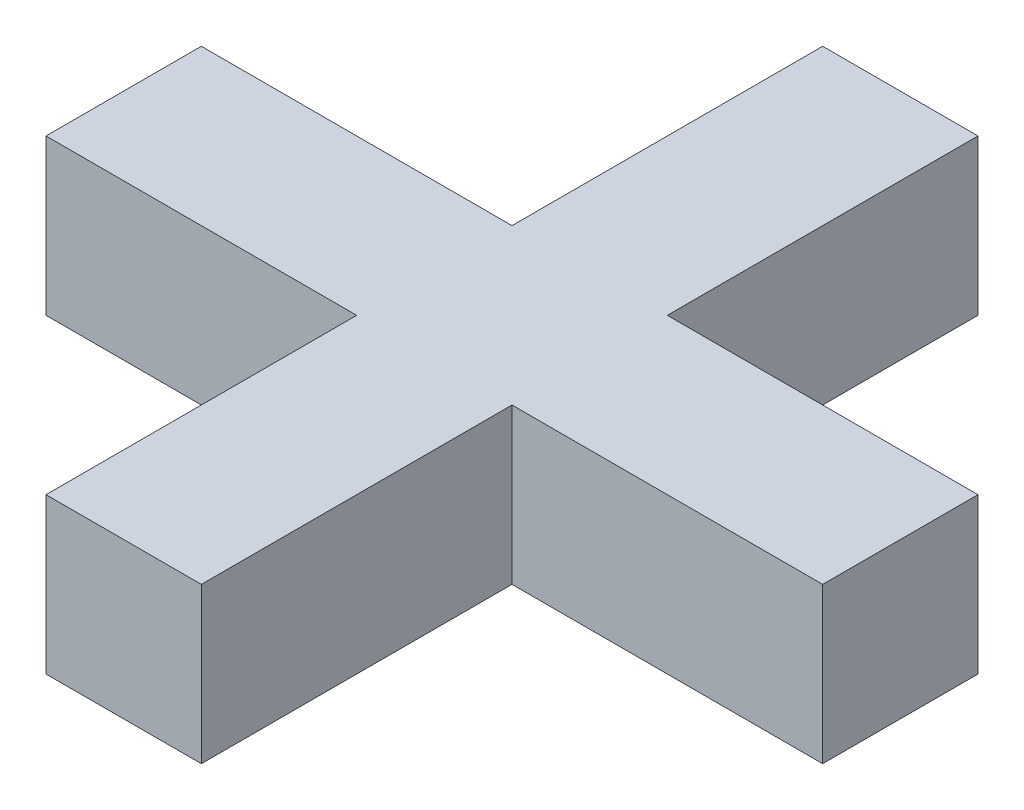
from build123d import *

# Parameters (mm, degrees)
SKETCH_1_W      = 400
SKETCH_1_H      = 200
SKETCH_1_W_2    = 200
SKETCH_1_H_2    = 400
EXTRUDE_1_DEPTH = 200


with BuildPart() as part:
    # 草圖1 → 填料-伸長1 (new body)
    with BuildSketch(Plane(origin=(0, 0, 0), x_dir=(1, 0, 0), z_dir=(0, 1, 0))):
        with Locations((-300, 0)):
            Rectangle(SKETCH_1_W, SKETCH_1_H)
        Rectangle(SKETCH_1_W_2, SKETCH_1_H)
        with Locations((300, 0)):
            Rectangle(SKETCH_1_W, SKETCH_1_H)
        with Locations((0, -300)):
            Rectangle(SKETCH_1_W_2, SKETCH_1_H_2)
        with Locations((0, 300)):
            Rectangle(SKETCH_1_W_2, SKETCH_1_H_2)
    extrude(amount=EXTRUDE_1_DEPTH)


solid = part.part
